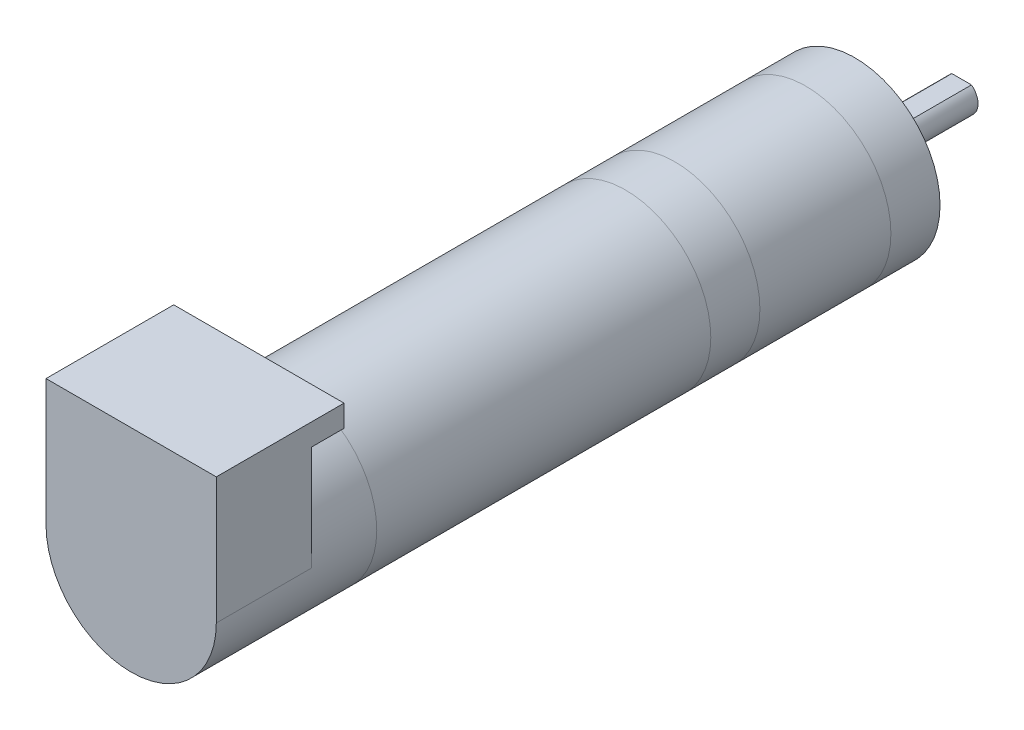
from build123d import *

# Parameters (mm, degrees)
ESQUISSE1_R         = 13
BOSS_EXTRU_1_DEPTH  = 7.5
ESQUISSE2_R         = 13
BOSS_EXTRU_2_DEPTH  = 20
ESQUISSE3_R         = 13
BOSS_EXTRU_3_DEPTH  = 7.5
ESQUISSE4_R         = 13
BOSS_EXTRU_4_DEPTH  = 51
ESQUISSE5_R         = 13
BOSS_EXTRU_5_DEPTH  = 10
BOSS_EXTRU_6_DEPTH  = 14.5
ESQUISSE7_W         = 26
ESQUISSE7_H         = 3.33041152
BOSS_EXTRU_7_DEPTH  = 5
ESQUISSE10_R        = 7
BOSS_EXTRU_8_DEPTH  = 2
ESQUISSE11_R        = 4
BOSS_EXTRU_9_DEPTH  = 2.5
BOSS_EXTRU_10_DEPTH = 11.8


with BuildPart() as part:
    # Esquisse1 → Boss.-Extru.1 (new body)
    with BuildSketch(Plane.XY):
        Circle(ESQUISSE1_R)
    extrude(amount=BOSS_EXTRU_1_DEPTH)

    # Esquisse10 → Boss.-Extru.8 (add)
    with BuildSketch(Plane(origin=(0, 0, 0), x_dir=(-1, 0, 0), z_dir=(0, 0, -1))):
        Circle(ESQUISSE10_R)
    extrude(amount=BOSS_EXTRU_8_DEPTH)

    # Esquisse11 → Boss.-Extru.9 (add)
    with BuildSketch(Plane(origin=(0, 0, -2), x_dir=(-1, 0, 0), z_dir=(0, 0, -1))):
        Circle(ESQUISSE11_R)
    extrude(amount=BOSS_EXTRU_9_DEPTH)

    # Esquisse12 → Boss.-Extru.10 (add)
    with BuildSketch(Plane(origin=(0, 0, -4.5), x_dir=(-1, 0, 0), z_dir=(0, 0, -1))):
        with BuildLine():
            Line((-1.5, 2), (1.5, 2))
            ThreePointArc((1.5, 2), (0, -2.5), (-1.5, 2))
        make_face()
    extrude(amount=BOSS_EXTRU_10_DEPTH)


with BuildPart() as body_2:
    # Esquisse2 → Boss.-Extru.2 (new body)
    with BuildSketch(Plane.XY.offset(7.5)):
        Circle(ESQUISSE2_R)
    extrude(amount=BOSS_EXTRU_2_DEPTH)


with BuildPart() as body_3:
    # Esquisse3 → Boss.-Extru.3 (new body)
    with BuildSketch(Plane.XY.offset(27.5)):
        Circle(ESQUISSE3_R)
    extrude(amount=BOSS_EXTRU_3_DEPTH)


with BuildPart() as body_4:
    # Esquisse4 → Boss.-Extru.4 (new body)
    with BuildSketch(Plane.XY.offset(35)):
        Circle(ESQUISSE4_R)
    extrude(amount=BOSS_EXTRU_4_DEPTH)


with BuildPart() as body_5:
    # Esquisse5 → Boss.-Extru.5 (new body)
    with BuildSketch(Plane.XY.offset(86)):
        Circle(ESQUISSE5_R)
    extrude(amount=BOSS_EXTRU_5_DEPTH)

    # Esquisse6 → Boss.-Extru.6 (add)
    with BuildSketch(Plane.XY.offset(96)):
        with BuildLine():
            Line((-13, 0), (-13, 19.321523154))
            Line((-13, 19.321523154), (13, 19.321523154))
            Line((13, 19.321523154), (13, 0))
            ThreePointArc((13, 0), (0, -13), (-13, 0))
        make_face()
    extrude(amount=BOSS_EXTRU_6_DEPTH)

    # Esquisse7 → Boss.-Extru.7 (add)
    with BuildSketch(Plane(origin=(0, 0, 96), x_dir=(-1, 0, 0), z_dir=(0, 0, -1))):
        with Locations((0, 17.656317394)):
            Rectangle(ESQUISSE7_W, ESQUISSE7_H)
    extrude(amount=BOSS_EXTRU_7_DEPTH)


solid = Compound([part.part, body_2.part, body_3.part, body_4.part, body_5.part])
